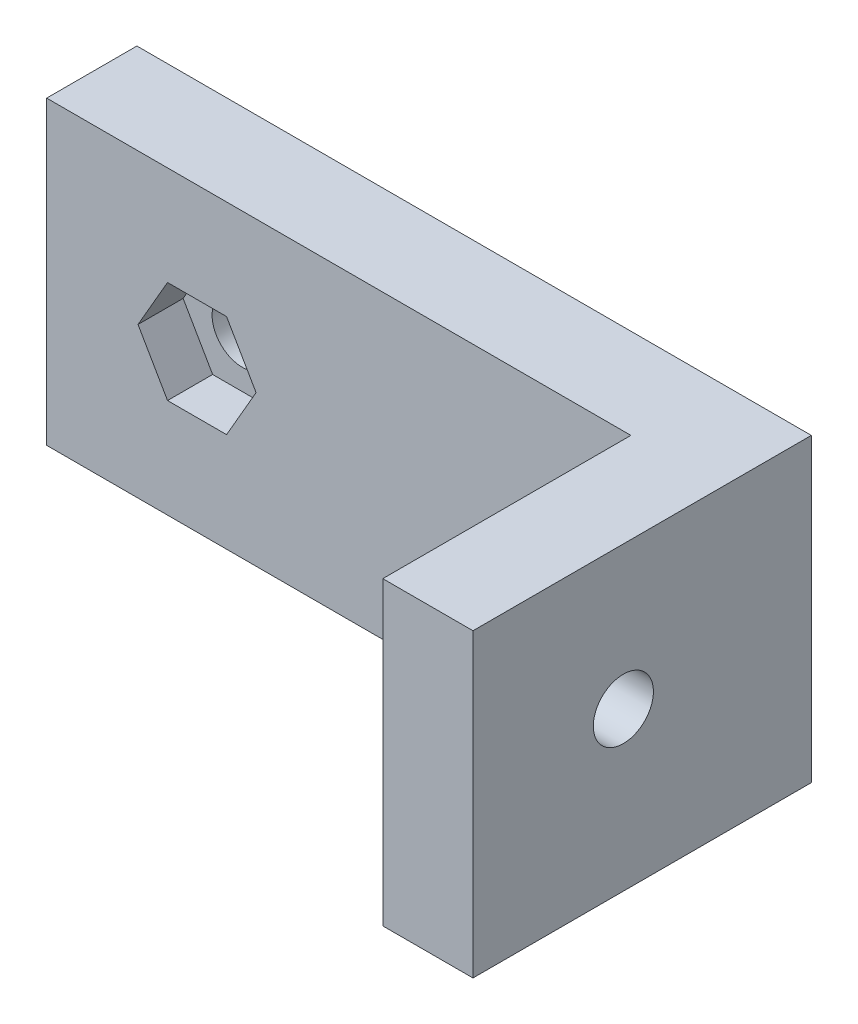
from build123d import *

# Parameters (mm, degrees)
SKETCH1_W           = 44.85
SKETCH1_H           = 20
SKETCH1_R           = 2
BOSS_EXTRUDE1_DEPTH = 3
BOSS_EXTRUDE2_START = 3
SKETCH1_4_W         = 44.85
SKETCH1_4_H         = 20
BOSS_EXTRUDE2_DEPTH = 3
SKETCH5_W           = 16.5
SKETCH5_H           = 20
SKETCH5_R           = 2
BOSS_EXTRUDE3_DEPTH = 3
BOSS_EXTRUDE4_START = 3
SKETCH5_3_W         = 16.5
SKETCH5_3_H         = 20
BOSS_EXTRUDE4_DEPTH = 3


with BuildPart() as part:
    # Sketch1 → Boss-Extrude1 (new body)
    # profile 1 of 2: a face of its own
    with BuildSketch(Plane.XY):
        with Locations((147.275, 2.5)):
            Rectangle(SKETCH1_W, SKETCH1_H)
        Polygon((132.887009085, 5.9), (130.92401817, 2.5), (132.887009085, -0.9), (136.812990915, -0.9), (138.77598183, 2.5), (136.812990915, 5.9), align=None, mode=Mode.SUBTRACT)
    # profile 2 of 2: a face of its own
    with BuildSketch(Plane.XY):
        Polygon((136.812990915, 5.9), (132.887009085, 5.9), (130.92401817, 2.5), (132.887009085, -0.9), (136.812990915, -0.9), (138.77598183, 2.5), align=None)
        with Locations((134.85, 2.5)):
            Circle(SKETCH1_R, mode=Mode.SUBTRACT)
    extrude(amount=BOSS_EXTRUDE1_DEPTH)

    # Sketch1<4> → Boss-Extrude2 (add)
    with BuildSketch(Plane.XY.offset(BOSS_EXTRUDE2_START)):
        with Locations((147.275, 2.5)):
            Rectangle(SKETCH1_4_W, SKETCH1_4_H)
        Polygon((132.887009085, 5.9), (130.92401817, 2.5), (132.887009085, -0.9), (136.812990915, -0.9), (138.77598183, 2.5), (136.812990915, 5.9), align=None, mode=Mode.SUBTRACT)
    extrude(amount=BOSS_EXTRUDE2_DEPTH)

    # Sketch5 → Boss-Extrude3 (add)
    # profile 1 of 2: a face of its own
    with BuildSketch(Plane.ZY.offset(-169.7)):
        with Locations((14.25, 2.5)):
            Rectangle(SKETCH5_W, SKETCH5_H)
        Polygon((9.1, 1.037009085), (12.5, -0.92598183), (15.9, 1.037009085), (15.9, 4.962990915), (12.5, 6.92598183), (9.1, 4.962990915), align=None, mode=Mode.SUBTRACT)
    # profile 2 of 2: a face of its own
    with BuildSketch(Plane.ZY.offset(-169.7)):
        Polygon((9.1, 4.962990915), (9.1, 1.037009085), (12.5, -0.92598183), (15.9, 1.037009085), (15.9, 4.962990915), (12.5, 6.92598183), align=None)
        with Locations(Location((12.5, 3, 0), (0, 0, 270))):
            Circle(SKETCH5_R, mode=Mode.SUBTRACT)
    extrude(amount=BOSS_EXTRUDE3_DEPTH)

    # Sketch5<3> → Boss-Extrude4 (add)
    with BuildSketch(Plane.ZY.offset(-169.7).offset(BOSS_EXTRUDE4_START)):
        with Locations((14.25, 2.5)):
            Rectangle(SKETCH5_3_W, SKETCH5_3_H)
        Polygon((9.1, 1.037009085), (12.5, -0.92598183), (15.9, 1.037009085), (15.9, 4.962990915), (12.5, 6.92598183), (9.1, 4.962990915), align=None, mode=Mode.SUBTRACT)
    extrude(amount=BOSS_EXTRUDE4_DEPTH)


solid = part.part
